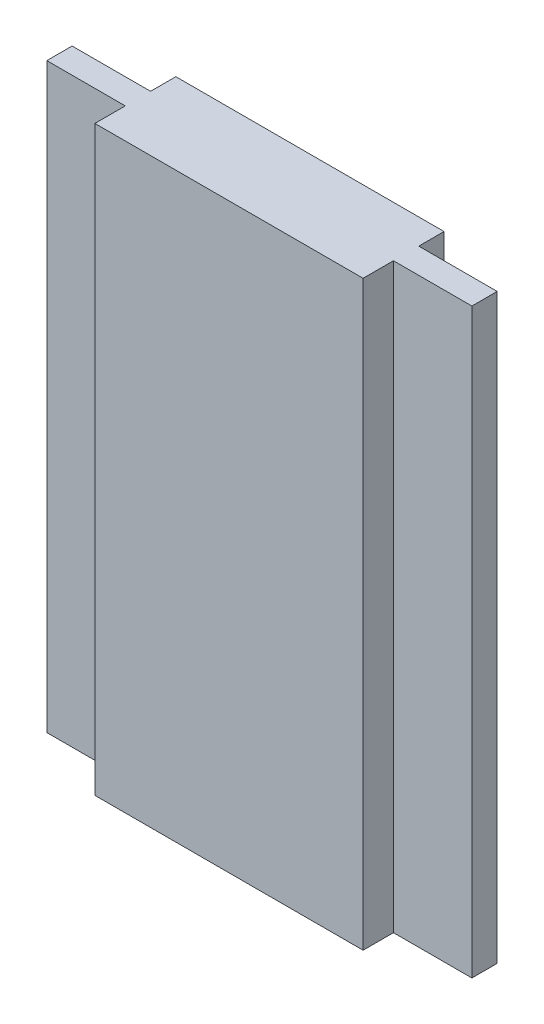
from build123d import *

# Parameters (mm, degrees)
SKETCH2_W               = 84
SKETCH2_H               = 115
BOSS_EXTRUDE1_DEPTH     = 15
SKETCH3_W               = 15.5
SKETCH3_H               = 5
CUT_EXTRUDE1_DEPTH      = 144.199162009
MIRROR2_COPY_1_SKETCH_W = 15.5
MIRROR2_COPY_1_SKETCH_H = 5
MIRROR2_COPY_1_DEPTH    = 144.199162009
MIRROR2_COPY_2_SKETCH_W = 15.5
MIRROR2_COPY_2_SKETCH_H = 5
MIRROR2_COPY_2_DEPTH    = 144.199162009
SKETCH4_W               = 53
SKETCH4_H               = 115
BOSS_EXTRUDE2_DEPTH     = 1


with BuildPart() as part:
    # Sketch2 → Boss-Extrude1 (new body)
    with BuildSketch(Plane.XY):
        with Locations((42, 57.5)):
            Rectangle(SKETCH2_W, SKETCH2_H)
    extrude(amount=BOSS_EXTRUDE1_DEPTH)

    # Sketch3 → Cut-Extrude1 (cut, through all)
    with BuildSketch(Plane(origin=(0, 115, 0), x_dir=(1, 0, 0), z_dir=(0, 1, 0))):
        with Locations((7.75, -12.5)):
            Rectangle(SKETCH3_W, SKETCH3_H)
    cut_extrude1 = extrude(amount=-CUT_EXTRUDE1_DEPTH, mode=Mode.SUBTRACT)

    # Mirror1: Cut-Extrude1 across plane
    add(cut_extrude1.mirror(Plane.XY.offset(7.5)), mode=Mode.SUBTRACT)

    # Mirror2 copy 1 sketch → Mirror2 copy 1 (cut, through all)
    with BuildSketch(Plane(origin=(84, 115, 15), x_dir=(-1, 0, 0), z_dir=(0, 1, 0))):
        with Locations((7.75, -12.5)):
            Rectangle(MIRROR2_COPY_1_SKETCH_W, MIRROR2_COPY_1_SKETCH_H)
    extrude(amount=-MIRROR2_COPY_1_DEPTH, mode=Mode.SUBTRACT)

    # Mirror2 copy 2 sketch → Mirror2 copy 2 (cut, through all)
    with BuildSketch(Plane(origin=(84, 115, 0), x_dir=(-1, 0, 0), z_dir=(0, 1, 0))):
        with Locations((7.75, 12.5)):
            Rectangle(MIRROR2_COPY_2_SKETCH_W, MIRROR2_COPY_2_SKETCH_H)
    extrude(amount=-MIRROR2_COPY_2_DEPTH, mode=Mode.SUBTRACT)

    # Sketch4 → Boss-Extrude2 (add)
    with BuildSketch(Plane.XY.offset(15)):
        with Locations((42, 57.5)):
            Rectangle(SKETCH4_W, SKETCH4_H)
    extrude(amount=BOSS_EXTRUDE2_DEPTH)


solid = part.part
